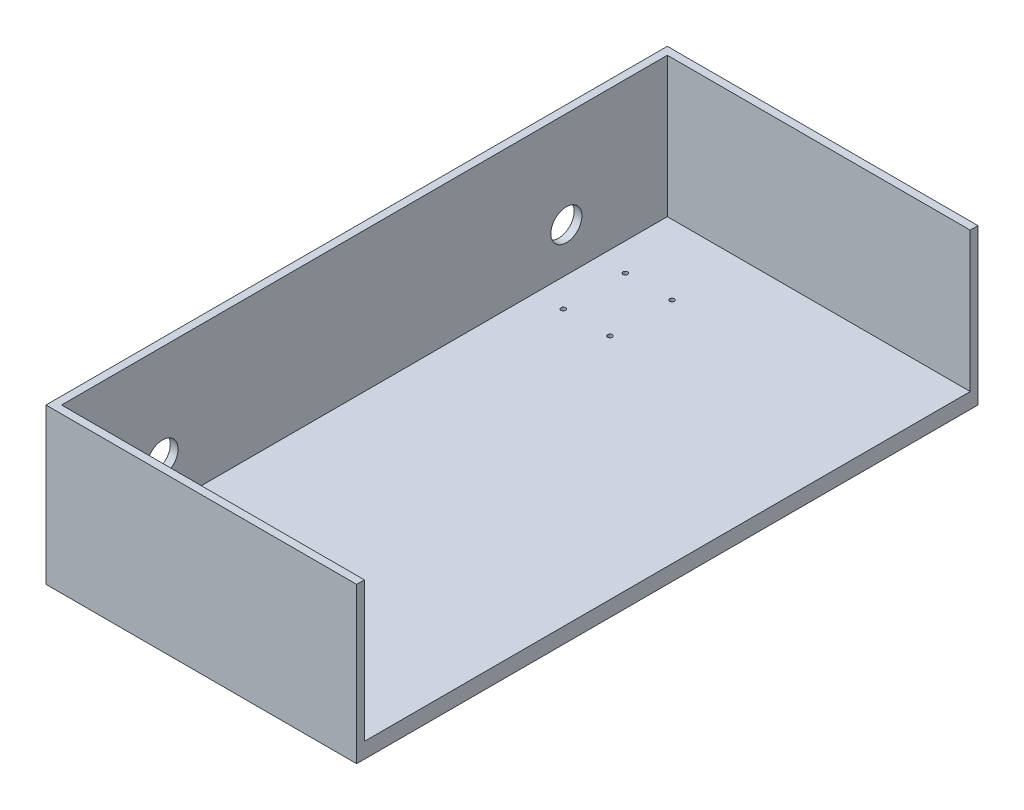
from build123d import *

# Parameters (mm, degrees)
ESQUISSE1_W             = 200
ESQUISSE1_H             = 400
BOSS_EXTRU_1_DEPTH      = 10
BOSS_EXTRU_2_DEPTH      = 90
ENL_V_MAT_EXTRU_1_REACH = 458.098
ESQUISSE3_R             = 10
ESQUISSE4_R             = 1.5
ENL_V_MAT_EXTRU_2_DEPTH = 5


with BuildPart() as part:
    # Esquisse1 → Boss.-Extru.1 (new body)
    with BuildSketch(Plane(origin=(0, 0, 0), x_dir=(1, 0, 0), z_dir=(0, 1, 0))):
        with Locations((100, 200)):
            Rectangle(ESQUISSE1_W, ESQUISSE1_H)
    extrude(amount=BOSS_EXTRU_1_DEPTH)

    # Esquisse2 → Boss.-Extru.2 (add)
    with BuildSketch(Plane(origin=(0, 10, 0), x_dir=(1, 0, 0), z_dir=(0, 1, 0))):
        Polygon((5, 5), (5, 395), (200, 395), (200, 400), (0, 400), (0, 0), (200, 0), (200, 5), align=None)
    extrude(amount=BOSS_EXTRU_2_DEPTH)

    # Esquisse3 → Enlèv. mat.-Extru.1 (cut, up to next)
    with BuildSketch(Plane(origin=(5, 0, 0), x_dir=(0, 0, -1), z_dir=(1, 0, 0)), mode=Mode.PRIVATE) as enl_v_mat_extru_1_sk1:
        with Locations((70, 38)):
            Circle(ESQUISSE3_R)
    enl_v_mat_extru_1_tool1 = extrude(enl_v_mat_extru_1_sk1.sketch, amount=-ENL_V_MAT_EXTRU_1_REACH, mode=Mode.PRIVATE) & part.part
    # Esquisse3 → Enlèv. mat.-Extru.1 (cut, up to next)
    with BuildSketch(Plane(origin=(5, 0, 0), x_dir=(0, 0, -1), z_dir=(1, 0, 0)), mode=Mode.PRIVATE) as enl_v_mat_extru_1_sk2:
        with Locations((330, 38)):
            Circle(ESQUISSE3_R)
    enl_v_mat_extru_1_tool2 = extrude(enl_v_mat_extru_1_sk2.sketch, amount=-ENL_V_MAT_EXTRU_1_REACH, mode=Mode.PRIVATE) & part.part
    add(enl_v_mat_extru_1_tool1.solids().sort_by_distance((5, 38, -70))[0], mode=Mode.SUBTRACT)
    add(enl_v_mat_extru_1_tool2.solids().sort_by_distance((5, 38, -330))[0], mode=Mode.SUBTRACT)

    # Esquisse4 → Enlèv. mat.-Extru.2 (cut)
    with BuildSketch(Plane(origin=(0, 10, 0), x_dir=(1, 0, 0), z_dir=(0, 1, 0))):
        with Locations(Location((23, 350, 0), (0, 0, 270))):
            Circle(ESQUISSE4_R)
        with Locations(Location((53, 350, 0), (0, 0, 270))):
            Circle(ESQUISSE4_R)
        with Locations(Location((53, 310, 0), (0, 0, 270))):
            Circle(ESQUISSE4_R)
        with Locations(Location((23, 310, 0), (0, 0, 270))):
            Circle(ESQUISSE4_R)
        with Locations(Location((23, 90, 0), (0, 0, 90))):
            Circle(ESQUISSE4_R)
        with Locations(Location((53, 90, 0), (0, 0, 90))):
            Circle(ESQUISSE4_R)
        with Locations(Location((53, 50, 0), (0, 0, 90))):
            Circle(ESQUISSE4_R)
        with Locations(Location((23, 50, 0), (0, 0, 90))):
            Circle(ESQUISSE4_R)
    extrude(amount=-ENL_V_MAT_EXTRU_2_DEPTH, mode=Mode.SUBTRACT)


solid = part.part
